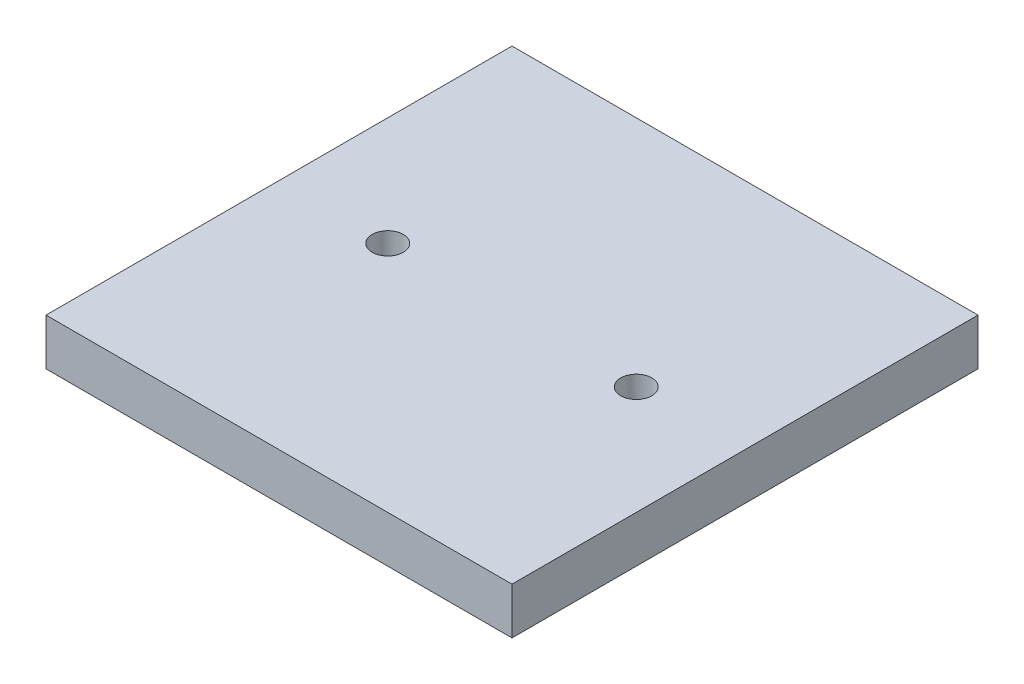
from build123d import *

# Parameters (mm, degrees)
SKETCH1_W           = 30
SKETCH1_H           = 30
BOSS_EXTRUDE1_DEPTH = 3
SKETCH2_R           = 1
CUT_EXTRUDE1_DEPTH  = 3


with BuildPart() as part:
    # Sketch1 → Boss-Extrude1 (new body)
    with BuildSketch(Plane(origin=(0, 0, 0), x_dir=(1, 0, 0), z_dir=(0, 1, 0))):
        Rectangle(SKETCH1_W, SKETCH1_H)
    extrude(amount=BOSS_EXTRUDE1_DEPTH)

    # Sketch2 → Cut-Extrude1 (cut)
    with BuildSketch(Plane(origin=(0, 3, 0), x_dir=(1, 0, 0), z_dir=(0, 1, 0))):
        with Locations(Location((-8, 0, 0), (0, 0, 270))):
            Circle(SKETCH2_R)
        with Locations(Location((8, 0, 0), (0, 0, 270))):
            Circle(SKETCH2_R)
    extrude(amount=-CUT_EXTRUDE1_DEPTH, mode=Mode.SUBTRACT)


solid = part.part
